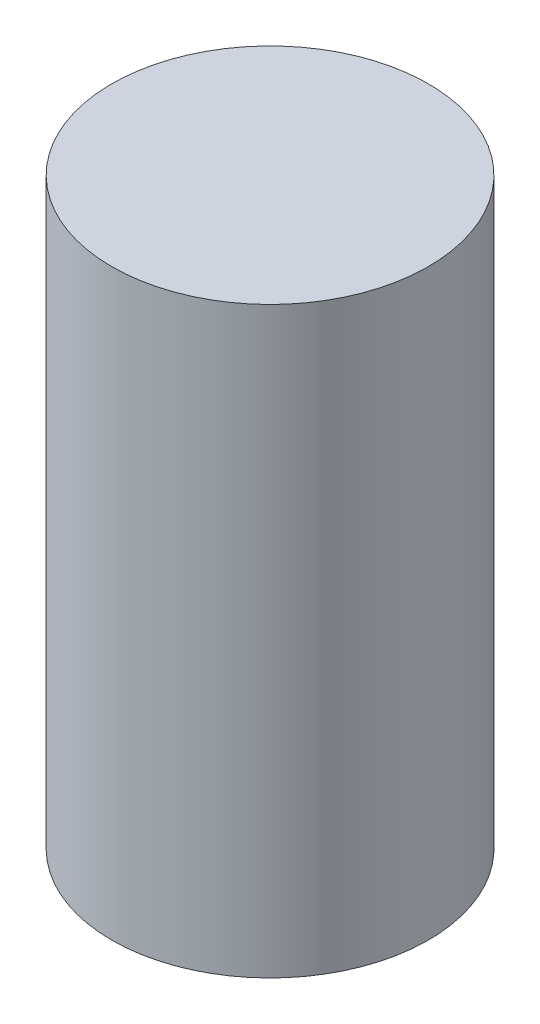
from build123d import *

# Parameters (mm, degrees)
SKETCH_1_R      = 38
EXTRUDE_1_DEPTH = 140
SHELL_1_T       = -3


with BuildPart() as part:
    # 草图1 → 拉伸1 (new body)
    with BuildSketch(Plane(origin=(0, 0, 0), x_dir=(1, 0, 0), z_dir=(0, 1, 0))):
        with Locations(Location((0, 0, 0), (0, 0, 270))):
            Circle(SKETCH_1_R)
    extrude(amount=EXTRUDE_1_DEPTH)

    # 抽壳1
    shell_1_openings = [part.faces().sort_by_distance(p)[0] for p in [
        (0, 0, 0),
    ]]
    offset(amount=SHELL_1_T, openings=shell_1_openings, kind=Kind.INTERSECTION)


solid = part.part
